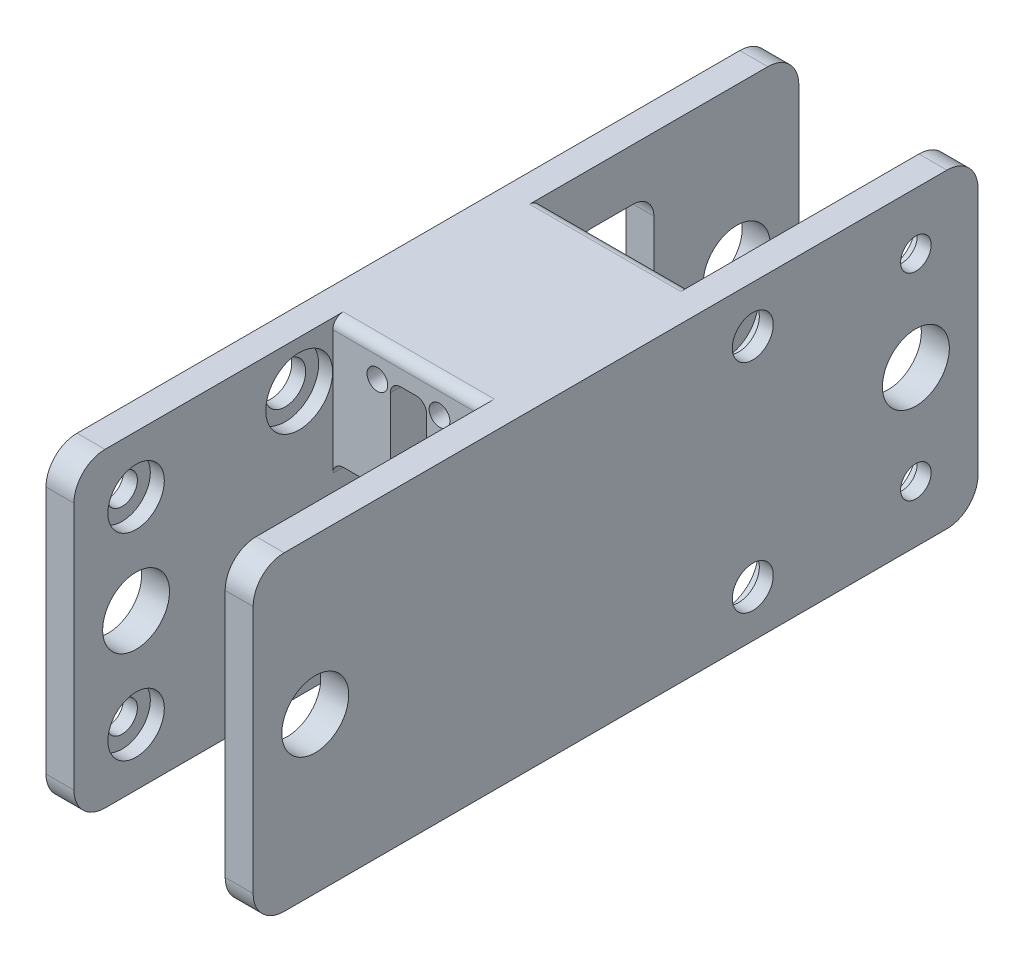
from build123d import *

# Parameters (mm, degrees)
SKETCH1_W             = 20
SKETCH1_H             = 20
BOSS_EXTRUDE3_DEPTH   = 30
CUT_EXTRUDE11_REACH   = 39.417
SKETCH10_R            = 0.86
FILLET4_R             = 1
SKETCH12_W            = 2.7
SKETCH12_H            = 30
BOSS_EXTRUDE13_DEPTH  = 25
CUT_EXTRUDE13_REACH   = 51.237
SKETCH14_R            = 3.23
FILLET6_R             = 3
SKETCH16_W            = 2.7
SKETCH16_H            = 30
BOSS_EXTRUDE14_DEPTH  = 25
CUT_EXTRUDE14_REACH   = 51.237
SKETCH17_R            = 3.23
FILLET11_R            = 3
FILLET6_OF_MIRROR1_R  = 3
FILLET11_OF_MIRROR1_R = 3
FILLET12_R            = 1
CUT_EXTRUDE15_REACH   = 57
SKETCH18_R            = 1
CUT_EXTRUDE16_REACH   = 51.237
SKETCH20_R            = 1.98
SKETCH20_R_2          = 1.475
CUT_EXTRUDE17_REACH   = 56.668
SKETCH21_R            = 1.98
SKETCH21_R_2          = 1.475
SKETCH22_R            = 2.725
SKETCH22_R_2          = 3.23
CUT_EXTRUDE18_DEPTH   = 1.35
SKETCH23_R            = 2.725
SKETCH23_R_2          = 3.23
CUT_EXTRUDE19_DEPTH   = 1.35
CUT_EXTRUDE20_REACH   = 52.249
SKETCH24_W            = 8
SKETCH24_H            = 20
FILLET13_R            = 2


with BuildPart() as part:
    # Sketch1 → Boss-Extrude3 (new body)
    with BuildSketch(Plane(origin=(0, 0, 0), x_dir=(1, 0, 0), z_dir=(0, 1, 0))):
        Rectangle(SKETCH1_W, SKETCH1_H)
    extrude(amount=BOSS_EXTRUDE3_DEPTH)

    # Sketch10 → Cut-Extrude11 (cut, up to next)
    with BuildSketch(Plane(origin=(0, 0, -10), x_dir=(-1, 0, 0), z_dir=(0, 0, -1)), mode=Mode.PRIVATE) as cut_extrude11_sk1:
        with Locations((-5.88, 19.86)):
            Circle(SKETCH10_R)
    cut_extrude11_tool1 = extrude(cut_extrude11_sk1.sketch, amount=-CUT_EXTRUDE11_REACH, mode=Mode.PRIVATE) & part.part
    # Sketch10 → Cut-Extrude11 (cut, up to next)
    with BuildSketch(Plane(origin=(0, 0, -10), x_dir=(-1, 0, 0), z_dir=(0, 0, -1)), mode=Mode.PRIVATE) as cut_extrude11_sk2:
        with Locations((-5.92, 9.33)):
            Circle(SKETCH10_R)
    cut_extrude11_tool2 = extrude(cut_extrude11_sk2.sketch, amount=-CUT_EXTRUDE11_REACH, mode=Mode.PRIVATE) & part.part
    # Sketch10 → Cut-Extrude11 (cut, up to next)
    with BuildSketch(Plane(origin=(0, 0, -10), x_dir=(-1, 0, 0), z_dir=(0, 0, -1)), mode=Mode.PRIVATE) as cut_extrude11_sk3:
        Polygon((-1.75, 27.5), (1.75, 27.5), (1.75, 18), (7.3, 18), (7.3, 12), (1.75, 12), (1.75, 2.5), (-1.75, 2.5), (-1.75, 12), (-7.3, 12), (-7.3, 18), (-1.75, 18), align=None)
    cut_extrude11_tool3 = extrude(cut_extrude11_sk3.sketch, amount=-CUT_EXTRUDE11_REACH, mode=Mode.PRIVATE) & part.part
    add(cut_extrude11_tool1.solids().sort_by_distance((5.88, 19.86, -10))[0], mode=Mode.SUBTRACT)
    add(cut_extrude11_tool2.solids().sort_by_distance((5.92, 9.33, -10))[0], mode=Mode.SUBTRACT)
    add(cut_extrude11_tool3.solids().sort_by_distance((0, 15, -10))[0], mode=Mode.SUBTRACT)

    # Fillet4
    fillet4_edges = [part.edges().sort_by_distance(p)[0] for p in [
        (-1.75, 2.5, 0),
        (1.75, 2.5, 0),
        (1.75, 12, 0),
        (7.3, 12, 0),
        (7.3, 18, 0),
        (1.75, 18, 0),
        (1.75, 27.5, 0),
        (-1.75, 27.5, 0),
        (-1.75, 18, 0),
        (-7.3, 18, 0),
        (-7.3, 12, 0),
        (-1.75, 12, 0),
    ]]
    fillet(fillet4_edges, radius=FILLET4_R)

    # Sketch12 → Boss-Extrude13 (add)
    with BuildSketch(Plane.XY.offset(10)):
        with Locations((-8.65, 15)):
            Rectangle(SKETCH12_W, SKETCH12_H)
    boss_extrude13 = extrude(amount=BOSS_EXTRUDE13_DEPTH)

    # Sketch14 → Cut-Extrude13 (cut, up to next)
    with BuildSketch(Plane(origin=(-7.3, 0, 0), x_dir=(0, 0, -1), z_dir=(1, 0, 0)), mode=Mode.PRIVATE) as cut_extrude13_sk1:
        with Locations(Location((-29, 15, 0), (0, 0, 90))):
            Circle(SKETCH14_R)
    cut_extrude13_tool1 = extrude(cut_extrude13_sk1.sketch, amount=-CUT_EXTRUDE13_REACH, mode=Mode.PRIVATE) & part.part
    cut_extrude13 = cut_extrude13_tool1.solids().sort_by_distance((-7.3, 15, 29))[0]
    add(cut_extrude13, mode=Mode.SUBTRACT)

    # Fillet6
    fillet6_edges = [part.edges().sort_by_distance(p)[0] for p in [
        (-8.65, 0, 35),
        (-8.65, 30, 35),
    ]]
    fillet(fillet6_edges, radius=FILLET6_R)

    # Sketch16 → Boss-Extrude14 (add)
    with BuildSketch(Plane(origin=(0, 0, -10), x_dir=(-1, 0, 0), z_dir=(0, 0, -1))):
        with Locations((8.65, 15)):
            Rectangle(SKETCH16_W, SKETCH16_H)
    boss_extrude14 = extrude(amount=BOSS_EXTRUDE14_DEPTH)

    # Sketch17 → Cut-Extrude14 (cut, up to next)
    with BuildSketch(Plane(origin=(-7.3, 0, 0), x_dir=(0, 0, -1), z_dir=(1, 0, 0)), mode=Mode.PRIVATE) as cut_extrude14_sk1:
        with Locations((29, 15)):
            Circle(SKETCH17_R)
    cut_extrude14_tool1 = extrude(cut_extrude14_sk1.sketch, amount=-CUT_EXTRUDE14_REACH, mode=Mode.PRIVATE) & part.part
    cut_extrude14 = cut_extrude14_tool1.solids().sort_by_distance((-7.3, 15, -29))[0]
    add(cut_extrude14, mode=Mode.SUBTRACT)

    # Fillet11
    fillet11_edges = [part.edges().sort_by_distance(p)[0] for p in [
        (-8.65, 30, -35),
        (-8.65, 0, -35),
    ]]
    fillet(fillet11_edges, radius=FILLET11_R)

    # Mirror1: Boss-Extrude13, Cut-Extrude13, Boss-Extrude14, Cut-Extrude14 across plane
    add(boss_extrude13.mirror(Plane(origin=(0, 0, 0), x_dir=(0, 0, 1), z_dir=(1, 0, 0))))
    add(cut_extrude13.mirror(Plane(origin=(0, 0, 0), x_dir=(0, 0, 1), z_dir=(1, 0, 0))), mode=Mode.SUBTRACT)
    add(boss_extrude14.mirror(Plane(origin=(0, 0, 0), x_dir=(0, 0, 1), z_dir=(1, 0, 0))))
    add(cut_extrude14.mirror(Plane(origin=(0, 0, 0), x_dir=(0, 0, 1), z_dir=(1, 0, 0))), mode=Mode.SUBTRACT)

    # Fillet6 of Mirror1
    fillet6_of_mirror1_edges = [part.edges().sort_by_distance(p)[0] for p in [
        (8.65, 0, 35),
        (8.65, 30, 35),
    ]]
    fillet(fillet6_of_mirror1_edges, radius=FILLET6_OF_MIRROR1_R)

    # Fillet11 of Mirror1
    fillet11_of_mirror1_edges = [part.edges().sort_by_distance(p)[0] for p in [
        (8.65, 30, -35),
        (8.65, 0, -35),
    ]]
    fillet(fillet11_of_mirror1_edges, radius=FILLET11_OF_MIRROR1_R)

    # Fillet12
    fillet12_edges = [part.edges().sort_by_distance(p)[0] for p in [
        (0, 0, 10),
        (0, 30, 10),
        (0, 0, -10),
        (0, 30, -10),
    ]]
    fillet(fillet12_edges, radius=FILLET12_R)

    # Sketch18 → Cut-Extrude15 (cut, up to next)
    with BuildSketch(Plane(origin=(0, 0, -10), x_dir=(-1, 0, 0), z_dir=(0, 0, -1)), mode=Mode.PRIVATE) as cut_extrude15_sk1:
        with Locations((-3, 27)):
            Circle(SKETCH18_R)
    cut_extrude15_tool1 = extrude(cut_extrude15_sk1.sketch, amount=-CUT_EXTRUDE15_REACH, mode=Mode.PRIVATE) & part.part
    # Sketch18 → Cut-Extrude15 (cut, up to next)
    with BuildSketch(Plane(origin=(0, 0, -10), x_dir=(-1, 0, 0), z_dir=(0, 0, -1)), mode=Mode.PRIVATE) as cut_extrude15_sk2:
        with Locations((3, 3)):
            Circle(SKETCH18_R)
    cut_extrude15_tool2 = extrude(cut_extrude15_sk2.sketch, amount=-CUT_EXTRUDE15_REACH, mode=Mode.PRIVATE) & part.part
    cut_extrude15_1 = cut_extrude15_tool1.solids().sort_by_distance((3, 27, -10))[0]
    add(cut_extrude15_1, mode=Mode.SUBTRACT)
    cut_extrude15_2 = cut_extrude15_tool2.solids().sort_by_distance((-3, 3, -10))[0]
    add(cut_extrude15_2, mode=Mode.SUBTRACT)
    cut_extrude15 = cut_extrude15_1 + cut_extrude15_2  # Cut-Extrude15 as one shape, for the pattern or mirror that repeats it

    # Mirror2: Cut-Extrude15 across plane
    add(cut_extrude15.mirror(Plane(origin=(0, 0, 0), x_dir=(0, 0, 1), z_dir=(1, 0, 0))), mode=Mode.SUBTRACT)

    # Sketch20 → Cut-Extrude16 (cut, up to next)
    with BuildSketch(Plane.ZY.offset(-7.3), mode=Mode.PRIVATE) as cut_extrude16_sk1:
        with Locations((-13.25, 25.48)):
            Circle(SKETCH20_R)
    cut_extrude16_tool1 = extrude(cut_extrude16_sk1.sketch, amount=-CUT_EXTRUDE16_REACH, mode=Mode.PRIVATE) & part.part
    # Sketch20 → Cut-Extrude16 (cut, up to next)
    with BuildSketch(Plane.ZY.offset(-7.3), mode=Mode.PRIVATE) as cut_extrude16_sk2:
        with Locations((-13.25, 4.52)):
            Circle(SKETCH20_R)
    cut_extrude16_tool2 = extrude(cut_extrude16_sk2.sketch, amount=-CUT_EXTRUDE16_REACH, mode=Mode.PRIVATE) & part.part
    # Sketch20 → Cut-Extrude16 (cut, up to next)
    with BuildSketch(Plane.ZY.offset(-7.3), mode=Mode.PRIVATE) as cut_extrude16_sk3:
        with Locations((-29, 5.48)):
            Circle(SKETCH20_R_2)
    cut_extrude16_tool3 = extrude(cut_extrude16_sk3.sketch, amount=-CUT_EXTRUDE16_REACH, mode=Mode.PRIVATE) & part.part
    # Sketch20 → Cut-Extrude16 (cut, up to next)
    with BuildSketch(Plane.ZY.offset(-7.3), mode=Mode.PRIVATE) as cut_extrude16_sk4:
        with Locations((-29, 24.52)):
            Circle(SKETCH20_R_2)
    cut_extrude16_tool4 = extrude(cut_extrude16_sk4.sketch, amount=-CUT_EXTRUDE16_REACH, mode=Mode.PRIVATE) & part.part
    add(cut_extrude16_tool1.solids().sort_by_distance((7.3, 25.48, -13.25))[0], mode=Mode.SUBTRACT)
    add(cut_extrude16_tool2.solids().sort_by_distance((7.3, 4.52, -13.25))[0], mode=Mode.SUBTRACT)
    add(cut_extrude16_tool3.solids().sort_by_distance((7.3, 5.48, -29))[0], mode=Mode.SUBTRACT)
    add(cut_extrude16_tool4.solids().sort_by_distance((7.3, 24.52, -29))[0], mode=Mode.SUBTRACT)

    # Sketch21 → Cut-Extrude17 (cut, up to next)
    with BuildSketch(Plane(origin=(-7.3, 0, 7.3), x_dir=(0, 0, 1), z_dir=(-1, 0, 0)), mode=Mode.PRIVATE) as cut_extrude17_sk1:
        with Locations(Location((5.95, 25.48, 0), (0, 0, 180))):
            Circle(SKETCH21_R)
    cut_extrude17_tool1 = extrude(cut_extrude17_sk1.sketch, amount=CUT_EXTRUDE17_REACH, mode=Mode.PRIVATE) & part.part
    # Sketch21 → Cut-Extrude17 (cut, up to next)
    with BuildSketch(Plane(origin=(-7.3, 0, 7.3), x_dir=(0, 0, 1), z_dir=(-1, 0, 0)), mode=Mode.PRIVATE) as cut_extrude17_sk2:
        with Locations(Location((5.95, 4.52, 0), (0, 0, 180))):
            Circle(SKETCH21_R)
    cut_extrude17_tool2 = extrude(cut_extrude17_sk2.sketch, amount=CUT_EXTRUDE17_REACH, mode=Mode.PRIVATE) & part.part
    # Sketch21 → Cut-Extrude17 (cut, up to next)
    with BuildSketch(Plane(origin=(-7.3, 0, 7.3), x_dir=(0, 0, 1), z_dir=(-1, 0, 0)), mode=Mode.PRIVATE) as cut_extrude17_sk3:
        with Locations(Location((21.7, 5.48, 0), (0, 0, 180))):
            Circle(SKETCH21_R_2)
    cut_extrude17_tool3 = extrude(cut_extrude17_sk3.sketch, amount=CUT_EXTRUDE17_REACH, mode=Mode.PRIVATE) & part.part
    # Sketch21 → Cut-Extrude17 (cut, up to next)
    with BuildSketch(Plane(origin=(-7.3, 0, 7.3), x_dir=(0, 0, 1), z_dir=(-1, 0, 0)), mode=Mode.PRIVATE) as cut_extrude17_sk4:
        with Locations(Location((21.7, 24.52, 0), (0, 0, 180))):
            Circle(SKETCH21_R_2)
    cut_extrude17_tool4 = extrude(cut_extrude17_sk4.sketch, amount=CUT_EXTRUDE17_REACH, mode=Mode.PRIVATE) & part.part
    add(cut_extrude17_tool1.solids().sort_by_distance((-7.3, 25.48, 13.25))[0], mode=Mode.SUBTRACT)
    add(cut_extrude17_tool2.solids().sort_by_distance((-7.3, 4.52, 13.25))[0], mode=Mode.SUBTRACT)
    add(cut_extrude17_tool3.solids().sort_by_distance((-7.3, 5.48, 29))[0], mode=Mode.SUBTRACT)
    add(cut_extrude17_tool4.solids().sort_by_distance((-7.3, 24.52, 29))[0], mode=Mode.SUBTRACT)

    # Sketch22 → Cut-Extrude18 (cut)
    with BuildSketch(Plane.ZY.offset(-7.3)):
        with Locations(Location((-29, 24.52, 0), (0, 0, 270))):
            Circle(SKETCH22_R)
        with Locations(Location((-13.25, 25.48, 0), (0, 0, 270))):
            Circle(SKETCH22_R_2)
        with Locations(Location((-13.25, 4.52, 0), (0, 0, 270))):
            Circle(SKETCH22_R_2)
        with Locations(Location((-29, 5.48, 0), (0, 0, 270))):
            Circle(SKETCH22_R)
    extrude(amount=-CUT_EXTRUDE18_DEPTH, mode=Mode.SUBTRACT)

    # Sketch23 → Cut-Extrude19 (cut)
    with BuildSketch(Plane(origin=(-7.3, 0, 0), x_dir=(0, 0, -1), z_dir=(1, 0, 0))):
        with Locations((-29, 24.52)):
            Circle(SKETCH23_R)
        with Locations((-13.25, 25.48)):
            Circle(SKETCH23_R_2)
        with Locations((-29, 5.48)):
            Circle(SKETCH23_R)
        with Locations((-13.25, 4.52)):
            Circle(SKETCH23_R_2)
    extrude(amount=-CUT_EXTRUDE19_DEPTH, mode=Mode.SUBTRACT)

    # Sketch24 → Cut-Extrude20 (cut, up to next)
    with BuildSketch(Plane.ZY.offset(10), mode=Mode.PRIVATE) as cut_extrude20_sk1:
        with Locations((-17, 15)):
            Rectangle(SKETCH24_W, SKETCH24_H)
    cut_extrude20_tool1 = extrude(cut_extrude20_sk1.sketch, amount=-CUT_EXTRUDE20_REACH, mode=Mode.PRIVATE) & part.part
    add(cut_extrude20_tool1.solids().sort_by_distance((-10, 15, -17))[0], mode=Mode.SUBTRACT)

    # Fillet13
    fillet13_edges = [part.edges().sort_by_distance(p)[0] for p in [
        (-8.65, 25, -13),
        (-8.65, 5, -13),
        (-8.65, 5, -21),
        (-8.65, 25, -21),
    ]]
    fillet(fillet13_edges, radius=FILLET13_R)


solid = part.part
